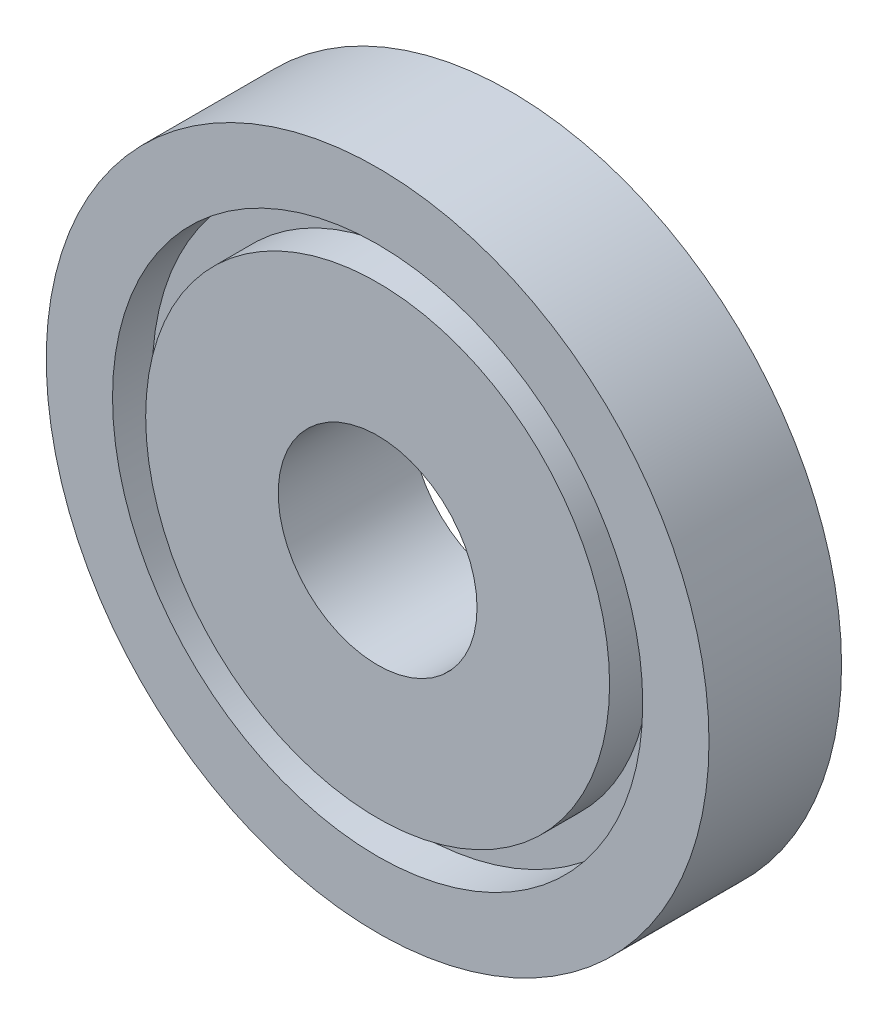
from build123d import *

# Parameters (mm, degrees)
SKETCH_1_R          = 50
EXTRUDE_1_DEPTH     = 10
SKETCH_2_R          = 15
CUT_EXTRUDE_1_DEPTH = 20
SKETCH_3_R          = 40
SKETCH_3_R_2        = 35
CUT_EXTRUDE_3_DEPTH = 6


with BuildPart() as part:
    # 草图1 → 凸台-拉伸1 (new, symmetric)
    with BuildSketch(Plane.XY):
        Circle(SKETCH_1_R)
    extrude(amount=EXTRUDE_1_DEPTH, both=True)

    # 草图2 → 切除-拉伸1 (cut)
    with BuildSketch(Plane.XY.offset(10)):
        Circle(SKETCH_2_R)
    extrude(amount=-CUT_EXTRUDE_1_DEPTH, mode=Mode.SUBTRACT)

    # 草图3 → 切除-拉伸3 (cut)
    with BuildSketch(Plane.XY.offset(10)):
        Circle(SKETCH_3_R)
        Circle(SKETCH_3_R_2, mode=Mode.SUBTRACT)
    cut_extrude_3 = extrude(amount=-CUT_EXTRUDE_3_DEPTH, mode=Mode.SUBTRACT)

    # 镜向1: 切除-拉伸3 across plane
    add(cut_extrude_3.mirror(Plane.XY), mode=Mode.SUBTRACT)


solid = part.part
